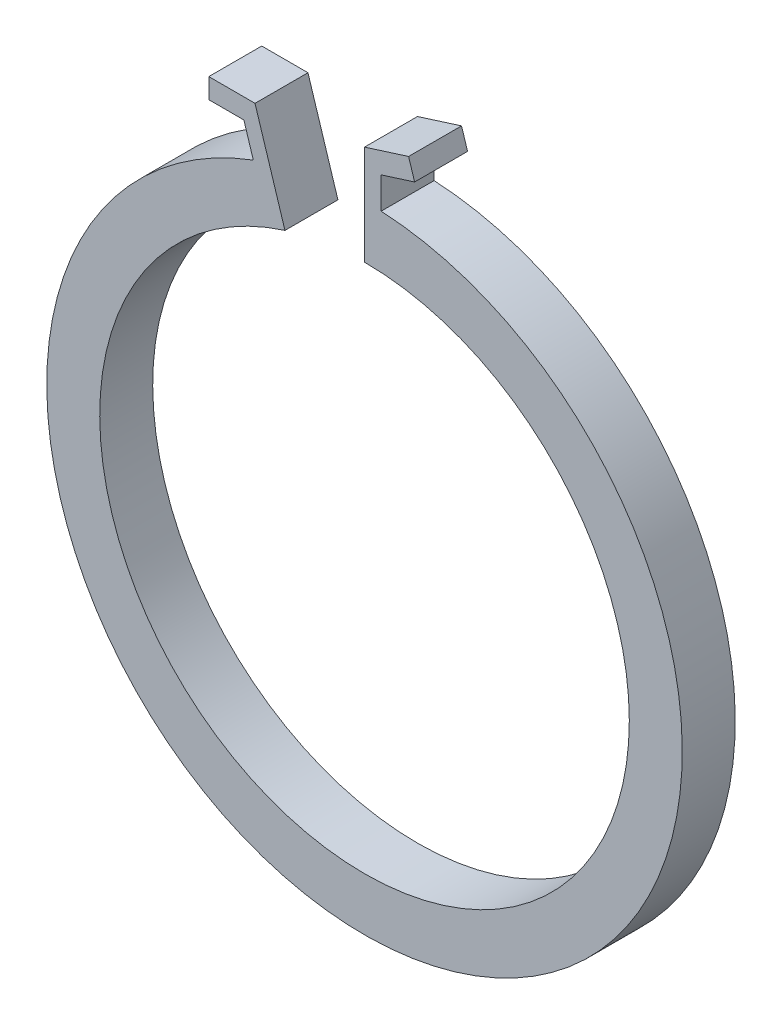
from build123d import *

# Parameters (mm, degrees)
SKETCH_1_R          = 6
SKETCH_1_R_2        = 5
EXTRUDE_1_DEPTH     = 1
CUT_EXTRUDE_1_DEPTH = 1
EXTRUDE_2_DEPTH     = 1


with BuildPart() as part:
    # 草图1 → 凸台-拉伸1 (new body)
    with BuildSketch(Plane.XY):
        Circle(SKETCH_1_R)
        Circle(SKETCH_1_R_2, mode=Mode.SUBTRACT)
    extrude(amount=EXTRUDE_1_DEPTH)

    # 草图2 → 切除-拉伸1 (cut)
    with BuildSketch(Plane.XY.offset(1)):
        Polygon((0, 0), (0, 9.552056019), (-2.79719818, 8.880094398), align=None)
    extrude(amount=-CUT_EXTRUDE_1_DEPTH, mode=Mode.SUBTRACT)

    # 草图3 → 凸台-拉伸2 (add)
    with BuildSketch(Plane.XY.offset(1)):
        Polygon((0, 6), (0, 6.882885988), (0.831959966, 7.145879705), (0.94595308, 6.785271442), (0.314049211, 6.585518144), (0.314049211, 5.991775454), align=None)
        Polygon((-2.099729946, 5.620599092), (-1.80266094, 5.722797702), (-2.067918288, 6.564894019), (-2.940456135, 6.56578037), (-2.940840318, 6.187583858), (-2.278116072, 6.186910643), align=None)
    extrude(amount=-EXTRUDE_2_DEPTH)


solid = part.part
